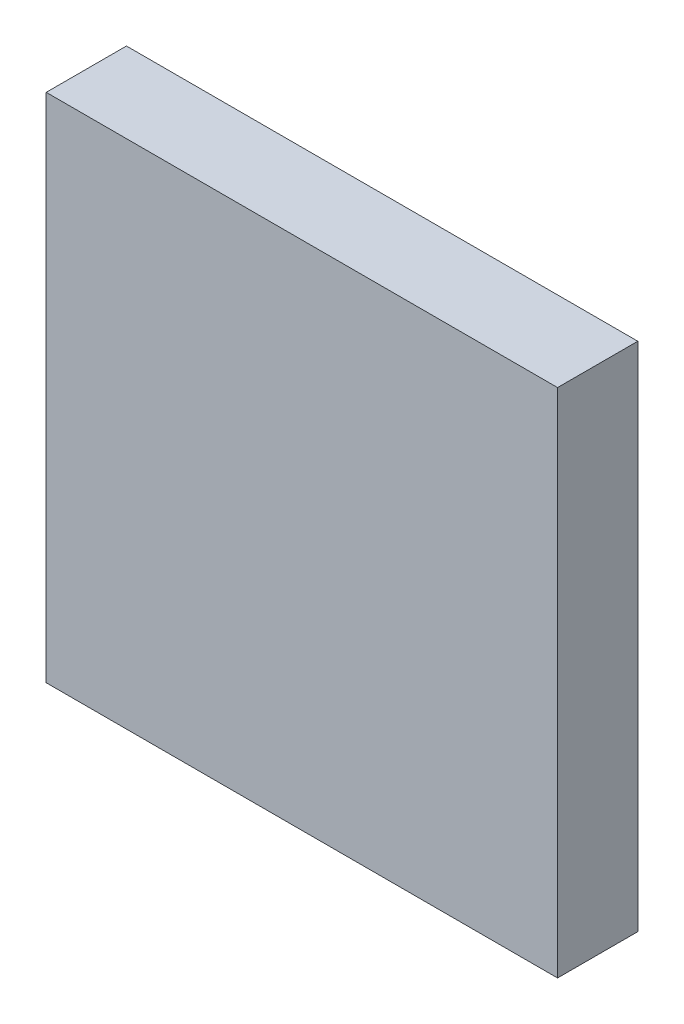
from build123d import *

# Parameters (mm, degrees)
SKETCH1_W           = 65
SKETCH1_H           = 65
BOSS_EXTRUDE1_DEPTH = 9
SKETCH2_W           = 65
SKETCH2_H           = 65
SKETCH2_W_2         = 60.2
SKETCH2_H_2         = 60.2
BOSS_EXTRUDE2_DEPTH = 1.2
SKETCH3_W           = 52.95
SKETCH3_H           = 52.95
CUT_EXTRUDE1_DEPTH  = 8
SKETCH4_W           = 2.557692308
SKETCH4_H           = 0.314102564
SKETCH4_W_2         = 0.314102564
SKETCH4_H_2         = 2.333333334
SKETCH4_H_3         = 2.333333333
CUT_EXTRUDE2_DEPTH  = 0.5


with BuildPart() as part:
    # Sketch1 → Boss-Extrude1 (new body)
    with BuildSketch(Plane.XY):
        with Locations((-5.537137766, -2.214696793)):
            Rectangle(SKETCH1_W, SKETCH1_H)
    extrude(amount=BOSS_EXTRUDE1_DEPTH)

    # Sketch2 → Boss-Extrude2 (add)
    with BuildSketch(Plane(origin=(0, 0, 0), x_dir=(-1, 0, 0), z_dir=(0, 0, -1))):
        with Locations((5.537137766, -2.214696793)):
            Rectangle(SKETCH2_W, SKETCH2_H)
        with Locations((5.537137766, -2.214696793)):
            Rectangle(SKETCH2_W_2, SKETCH2_H_2, mode=Mode.SUBTRACT)
    extrude(amount=BOSS_EXTRUDE2_DEPTH)

    # Sketch3 → Cut-Extrude1 (cut)
    with BuildSketch(Plane(origin=(0, 0, 0), x_dir=(-1, 0, 0), z_dir=(0, 0, -1))):
        with Locations((5.537137766, -2.214696793)):
            Rectangle(SKETCH3_W, SKETCH3_H)
    extrude(amount=-CUT_EXTRUDE1_DEPTH, mode=Mode.SUBTRACT)

    # Sketch4 → Cut-Extrude2 (cut)
    # profile 1 of 18: a face of its own
    with BuildSketch(Plane.ZY.offset(38.037137766)):
        with BuildLine():
            Line((3.58974359, 24.418743885), (0, 24.418743885))
            Line((0, 24.418743885), (0, 24.732846449))
            Line((0, 24.732846449), (0.442407853, 24.732846449))
            add(Edge.make_bspline(
                [(0.442407853, 24.732846449), (0.402357452, 24.768257833), (0.32419859, 24.837363595), (0.222394827, 24.952763581), (0.137553673, 25.074578698), (0.069666853, 25.203220871), (0.018284474, 25.338305204), (-0.017849104, 25.479446472), (-0.041371077, 25.626456568), (-0.04369442, 25.726712384), (-0.044871795, 25.777517923)],
                knots=[0, 0, 0, 0, 1.074295371, 2.096500925, 3.086030275, 4.053105238, 5.014108356, 5.985331429, 6.979048527, 8, 8, 8, 8], degree=3))
            add(Edge.make_bspline(
                [(-0.044871795, 25.777517923), (-0.043645626, 25.822686), (-0.041227567, 25.911759447), (-0.022462337, 26.042786759), (0.007657479, 26.168885525), (0.049598139, 26.290136111), (0.10494392, 26.405716945), (0.171919959, 26.516279293), (0.25089654, 26.622081189), (0.341535176, 26.721110502), (0.439877501, 26.812417983), (0.545073941, 26.892302806), (0.655679624, 26.960007795), (0.771663464, 27.01564917), (0.892940677, 27.058707384), (1.019428064, 27.088664249), (1.150915158, 27.107409258), (1.240455063, 27.109826092), (1.285857372, 27.111051577)],
                knots=[0, 0, 0, 0, 1.034036272, 2.039165313, 3.024406509, 3.999331371, 4.971254918, 5.953351348, 6.95522652, 7.989525907, 9.023492927, 10.024309745, 11.009187477, 11.988246066, 12.964946762, 13.950187958, 14.960617622, 16, 16, 16, 16], degree=3))
            add(Edge.make_bspline(
                [(1.285857372, 27.111051577), (1.330321265, 27.109798911), (1.418223983, 27.107322457), (1.547499942, 27.088864827), (1.672028314, 27.057850101), (1.791347799, 27.014241932), (1.905938937, 26.958570969), (2.014905164, 26.889701608), (2.119913357, 26.809845571), (2.21759609, 26.717562244), (2.307499363, 26.617644107), (2.386667873, 26.51125026), (2.453472192, 26.399707328), (2.507777609, 26.282791651), (2.550931998, 26.161331097), (2.581014763, 26.034402994), (2.598698613, 25.902584559), (2.601263226, 25.813095008), (2.602564103, 25.767702218)],
                knots=[0, 0, 0, 0, 1.02050356, 2.017480486, 2.990790918, 3.96161403, 4.928589988, 5.909588639, 6.91611943, 7.952353252, 8.989586576, 9.99823133, 10.991940466, 11.968822692, 12.952985106, 13.945868367, 14.958059758, 16, 16, 16, 16], degree=3))
            add(Edge.make_bspline(
                [(2.602564103, 25.767702218), (2.601004429, 25.715483081), (2.597942964, 25.612982719), (2.572093139, 25.462896042), (2.529212784, 25.320782238), (2.469910644, 25.186140284), (2.393386215, 25.059770513), (2.300152765, 24.941153953), (2.189114341, 24.831178187), (2.105480776, 24.766123426), (2.062700321, 24.732846449)],
                knots=[0, 0, 0, 0, 1.030970925, 2.023681352, 2.997808474, 3.956843046, 4.921958419, 5.908293655, 6.930045022, 8, 8, 8, 8], degree=3))
            Line((2.062700321, 24.732846449), (3.58974359, 24.732846449))
            Line((3.58974359, 24.732846449), (3.58974359, 24.418743885))
        make_face()
        with BuildLine():
            add(Edge.make_bspline(
                [(2.288461538, 25.763495487), (2.286827918, 25.809409853), (2.283603412, 25.900037507), (2.258429663, 26.03308111), (2.216546024, 26.160396026), (2.159260529, 26.281336451), (2.087245119, 26.394025615), (2.000074446, 26.494641812), (1.900520567, 26.584388808), (1.787746484, 26.658590078), (1.668225935, 26.72114913), (1.542337959, 26.764049108), (1.413575056, 26.792596145), (1.326206752, 26.795494279), (1.282351763, 26.796949013)],
                knots=[0, 0, 0, 0, 1.031093775, 2.03521511, 3.029845951, 4.035119871, 5.034286494, 6.024708811, 7.017619509, 8.03559408, 9.050082311, 10.039808432, 11.016071318, 12, 12, 12, 12], degree=3))
            add(Edge.make_bspline(
                [(1.282351763, 26.796949013), (1.238767492, 26.795066929), (1.151769786, 26.791310137), (1.022624311, 26.764801587), (0.897243126, 26.718871256), (0.776066955, 26.657740121), (0.66306139, 26.58187446), (0.561560746, 26.492872304), (0.474040482, 26.390973068), (0.400785993, 26.278039472), (0.341819613, 26.157604296), (0.300239861, 26.030892655), (0.273984486, 25.90013091), (0.270820672, 25.811060344), (0.269230769, 25.766299975)],
                knots=[0, 0, 0, 0, 0.979154363, 1.954470772, 2.947816011, 3.971783346, 4.997163654, 5.998045606, 6.995988793, 8.00538986, 9.015323546, 10.000094788, 10.994993517, 12, 12, 12, 12], degree=3))
            add(Edge.make_bspline(
                [(0.269230769, 25.766299975), (0.270865873, 25.720848072), (0.274109662, 25.630678657), (0.299704414, 25.497321916), (0.341067285, 25.367706983), (0.399172696, 25.24376192), (0.470855123, 25.128383469), (0.555144025, 25.024961361), (0.652350119, 24.936650559), (0.760039451, 24.862618306), (0.877544377, 24.804136537), (1.003184173, 24.762888588), (1.135971494, 24.737554641), (1.226849293, 24.734437546), (1.273237179, 24.732846449)],
                knots=[0, 0, 0, 0, 1.017484689, 2.018529338, 3.030031036, 4.058138743, 5.076350332, 6.065651025, 7.036469986, 8.00785331, 8.984076697, 9.96571663, 10.961615403, 12, 12, 12, 12], degree=3))
            add(Edge.make_bspline(
                [(1.273237179, 24.732846449), (1.308574996, 24.73380612), (1.378131003, 24.735695058), (1.480258715, 24.75012541), (1.577991728, 24.77308113), (1.671437013, 24.805424413), (1.760062376, 24.847926433), (1.844562515, 24.899133738), (1.924150324, 24.960096666), (1.998725013, 25.02895996), (2.066404356, 25.10518699), (2.126056362, 25.186244558), (2.176538373, 25.271928722), (2.216937187, 25.362179339), (2.249849087, 25.45630129), (2.271586828, 25.555196718), (2.286560777, 25.657868937), (2.28782128, 25.727915925), (2.288461538, 25.763495487)],
                knots=[0, 0, 0, 0, 1.050062701, 2.066855696, 3.059271411, 4.030305351, 4.999747758, 5.975466543, 6.961907836, 7.974539719, 8.98812422, 9.98710676, 10.961662635, 11.93785114, 12.922015094, 13.919620009, 14.94329489, 16, 16, 16, 16], degree=3))
        make_face(mode=Mode.SUBTRACT)
    # profile 2 of 18: a face of its own
    with BuildSketch(Plane.ZY.offset(38.037137766)):
        with BuildLine():
            add(Edge.make_bspline(
                [(3.634615385, 23.590017923), (3.63370731, 23.570529862), (3.631929126, 23.532368495), (3.616823357, 23.477129001), (3.590827583, 23.426880205), (3.557084436, 23.381645614), (3.515769317, 23.344148217), (3.46882621, 23.317260588), (3.41772133, 23.300095607), (3.382112539, 23.298010594), (3.363982372, 23.296949013)],
                knots=[0, 0, 0, 0, 1.054986045, 2.065865298, 3.074122704, 4.105114675, 5.109626121, 6.074217918, 7.019490725, 8, 8, 8, 8], degree=3))
            add(Edge.make_bspline(
                [(3.363982372, 23.296949013), (3.346322808, 23.298034343), (3.311411939, 23.300179911), (3.261193153, 23.317247899), (3.214903719, 23.344373638), (3.173669374, 23.381620656), (3.13994572, 23.426886797), (3.113944797, 23.477127258), (3.098840388, 23.532368953), (3.097062016, 23.570530017), (3.096153846, 23.590017923)],
                knots=[0, 0, 0, 0, 0.961106377, 1.899993565, 2.859409042, 3.870007927, 4.90724781, 5.921615355, 6.938620636, 8, 8, 8, 8], degree=3))
            add(Edge.make_bspline(
                [(3.096153846, 23.590017923), (3.097032849, 23.609282006), (3.098743713, 23.646777028), (3.114125508, 23.701000829), (3.139889179, 23.750441105), (3.174136064, 23.794935941), (3.214629537, 23.832921434), (3.261228119, 23.859947087), (3.311403037, 23.877060709), (3.346319817, 23.879200127), (3.363982372, 23.880282346)],
                knots=[0, 0, 0, 0, 1.055304112, 2.054011575, 3.063363921, 4.096942562, 5.122536081, 6.088009498, 7.032825006, 8, 8, 8, 8], degree=3))
            add(Edge.make_bspline(
                [(3.363982372, 23.880282346), (3.382115643, 23.879223991), (3.417730531, 23.877145316), (3.468790647, 23.859933804), (3.516045838, 23.833149636), (3.556618084, 23.794911397), (3.590884, 23.75044753), (3.616642695, 23.700999156), (3.63202579, 23.646777472), (3.633736474, 23.609282157), (3.634615385, 23.590017923)],
                knots=[0, 0, 0, 0, 0.986662878, 1.937868148, 2.908513651, 3.927890639, 4.955204348, 5.958438607, 6.951092507, 8, 8, 8, 8], degree=3))
        make_face()
    # profile 3 of 18: a face of its own
    with BuildSketch(Plane.ZY.offset(38.037137766)):
        with Locations((1.278846154, 23.58861568)):
            Rectangle(SKETCH4_W, SKETCH4_H)
    # profile 4 of 18: a face of its own
    with BuildSketch(Plane.ZY.offset(38.037137766)):
        with BuildLine():
            Line((2.238681891, 21.502077218), (2.019230769, 21.715218244))
            add(Edge.make_bspline(
                [(2.019230769, 21.715218244), (2.040548523, 21.73360573), (2.081646644, 21.769054639), (2.136522231, 21.825326376), (2.182990263, 21.881362136), (2.221225502, 21.936866372), (2.251316988, 21.991942663), (2.272570288, 22.047061255), (2.285913033, 22.102070895), (2.287622239, 22.138859883), (2.288461538, 22.156924975)],
                knots=[0, 0, 0, 0, 1.265880991, 2.440469525, 3.530740057, 4.536711111, 5.468008477, 6.34654737, 7.188078389, 8, 8, 8, 8], degree=3))
            add(Edge.make_bspline(
                [(2.288461538, 22.156924975), (2.287376181, 22.179058179), (2.285240351, 22.222613194), (2.264344046, 22.284934049), (2.231498561, 22.342383902), (2.185841467, 22.392539759), (2.132806978, 22.434797791), (2.074229729, 22.466827007), (2.01054531, 22.485582671), (1.966533213, 22.488020343), (1.944210737, 22.489256705)],
                knots=[0, 0, 0, 0, 1.000196853, 1.968245854, 2.94569445, 3.981000421, 5.021494845, 6.007172807, 6.989258906, 8, 8, 8, 8], degree=3))
            add(Edge.make_bspline(
                [(1.944210737, 22.489256705), (1.923998693, 22.488145893), (1.883631582, 22.4859274), (1.824083548, 22.468680721), (1.76602651, 22.441214648), (1.730463604, 22.415544454), (1.712139423, 22.402317603)],
                knots=[0, 0, 0, 0, 0.960159726, 1.917612774, 2.927026955, 4, 4, 4, 4], degree=3))
            add(Edge.make_bspline(
                [(1.712139423, 22.402317603), (1.702354839, 22.394354109), (1.681529584, 22.377404816), (1.652625731, 22.345596301), (1.62068348, 22.309573798), (1.588746643, 22.266253861), (1.555114918, 22.217502833), (1.521112785, 22.162263548), (1.48414836, 22.102289043), (1.460703924, 22.059351737), (1.448517628, 22.037033148)],
                knots=[0, 0, 0, 0, 0.66740084, 1.420478572, 2.27185888, 3.217733974, 4.268547843, 5.408967954, 6.65319498, 8, 8, 8, 8], degree=3))
            add(Edge.make_bspline(
                [(1.448517628, 22.037033148), (1.433272725, 22.00981957), (1.403824593, 21.9572519), (1.358114889, 21.882559133), (1.312683465, 21.814772092), (1.268016191, 21.753316425), (1.222863324, 21.699374616), (1.178955567, 21.651310063), (1.134966258, 21.610321619), (1.104233145, 21.587367692), (1.089543269, 21.576396128)],
                knots=[0, 0, 0, 0, 1.27191281, 2.456916733, 3.569705269, 4.599008579, 5.553216877, 6.436649441, 7.252746552, 8, 8, 8, 8], degree=3))
            add(Edge.make_bspline(
                [(1.089543269, 21.576396128), (1.059909466, 21.558094323), (1.00100518, 21.5217151), (0.903351967, 21.485002573), (0.800629714, 21.461537231), (0.729999555, 21.458664918), (0.694110577, 21.457205423)],
                knots=[0, 0, 0, 0, 0.995606783, 1.979007074, 2.973082153, 4, 4, 4, 4], degree=3))
            add(Edge.make_bspline(
                [(0.694110577, 21.457205423), (0.668840613, 21.457923306), (0.619043389, 21.459337972), (0.545720292, 21.469219735), (0.475542604, 21.486087601), (0.408099681, 21.509467354), (0.343522979, 21.539448322), (0.282298951, 21.577129536), (0.223907606, 21.620819131), (0.168677169, 21.67026099), (0.118568111, 21.725173868), (0.074973865, 21.784222006), (0.038155825, 21.84651615), (0.007930161, 21.912071495), (-0.016148907, 21.981027373), (-0.032808467, 22.0534408), (-0.042782037, 22.129068973), (-0.044166401, 22.180498861), (-0.044871795, 22.206704622)],
                knots=[0, 0, 0, 0, 1.032633728, 2.034917567, 3.017159222, 3.977707287, 4.947659047, 5.920662675, 6.910168127, 7.92466491, 8.94557085, 9.942744688, 10.919024275, 11.897637117, 12.88838639, 13.898512555, 14.929200919, 16, 16, 16, 16], degree=3))
            add(Edge.make_bspline(
                [(-0.044871795, 22.206704622), (-0.043879095, 22.242071797), (-0.041907487, 22.312314724), (-0.023401426, 22.416204443), (0.005393968, 22.517725202), (0.045109902, 22.616108742), (0.095260615, 22.709154856), (0.155323008, 22.794285781), (0.223313006, 22.871797243), (0.275425916, 22.915915517), (0.301482372, 22.937974654)],
                knots=[0, 0, 0, 0, 1.013940152, 2.01379169, 3.017749504, 4.037548394, 5.051665909, 6.043208538, 7.021604269, 8, 8, 8, 8], degree=3))
            Line((0.301482372, 22.937974654), (0.538461538, 22.729741481))
            add(Edge.make_bspline(
                [(0.538461538, 22.729741481), (0.517106774, 22.709969068), (0.475707334, 22.671637256), (0.420582993, 22.610336039), (0.374381722, 22.547956638), (0.335738307, 22.485121951), (0.305962904, 22.420901857), (0.28504431, 22.355656243), (0.271600118, 22.289517819), (0.270021836, 22.245095683), (0.269230769, 22.222830423)],
                knots=[0, 0, 0, 0, 1.179806542, 2.287233372, 3.337373186, 4.324005949, 5.273901747, 6.200048787, 7.097828587, 8, 8, 8, 8], degree=3))
            add(Edge.make_bspline(
                [(0.269230769, 22.222830423), (0.270601594, 22.192512497), (0.273279956, 22.133276356), (0.297597048, 22.048432597), (0.335727, 21.970093971), (0.389811698, 21.902070625), (0.452767271, 21.844168464), (0.52368139, 21.80224029), (0.600472847, 21.775964114), (0.653705149, 21.772878116), (0.680789263, 21.771307987)],
                knots=[0, 0, 0, 0, 1.072336372, 2.095165389, 3.102688358, 4.141489647, 5.156069229, 6.117746104, 7.042326257, 8, 8, 8, 8], degree=3))
            add(Edge.make_bspline(
                [(0.680789263, 21.771307987), (0.703098881, 21.772394282), (0.747146237, 21.774539024), (0.810896578, 21.791382296), (0.871365859, 21.817995149), (0.906755506, 21.844199797), (0.924779647, 21.857545968)],
                knots=[0, 0, 0, 0, 1.013901739, 2.00181326, 2.98231254, 4, 4, 4, 4], degree=3))
            add(Edge.make_bspline(
                [(0.924779647, 21.857545968), (0.93381501, 21.865568363), (0.953497292, 21.883044035), (0.98192237, 21.915099276), (1.01256047, 21.953481138), (1.044892059, 21.998621301), (1.078490664, 22.050610763), (1.113180016, 22.109660239), (1.150607742, 22.174960791), (1.175427397, 22.221131423), (1.188401442, 22.245266321)],
                knots=[0, 0, 0, 0, 0.615000592, 1.339693406, 2.178160186, 3.116406724, 4.166410947, 5.330106347, 6.604359322, 8, 8, 8, 8], degree=3))
            add(Edge.make_bspline(
                [(1.188401442, 22.245266321), (1.202940574, 22.271312961), (1.23113659, 22.321825708), (1.275052671, 22.393372999), (1.319719945, 22.457920353), (1.362632784, 22.517020928), (1.406053728, 22.569181934), (1.45003098, 22.614197882), (1.492790966, 22.653841098), (1.523088263, 22.675788509), (1.537560096, 22.68627193)],
                knots=[0, 0, 0, 0, 1.262093308, 2.447601706, 3.550203992, 4.582594899, 5.537233252, 6.418365656, 7.244515135, 8, 8, 8, 8], degree=3))
            add(Edge.make_bspline(
                [(1.537560096, 22.68627193), (1.566705711, 22.704402529), (1.625007126, 22.740670065), (1.722317603, 22.775885256), (1.824762661, 22.800091285), (1.895449515, 22.802253675), (1.931590545, 22.803359269)],
                knots=[0, 0, 0, 0, 0.985009483, 1.970363186, 2.962279964, 4, 4, 4, 4], degree=3))
            add(Edge.make_bspline(
                [(1.931590545, 22.803359269), (1.955215889, 22.802824997), (2.001454035, 22.801779349), (2.069393613, 22.793436387), (2.133939, 22.778240702), (2.196075886, 22.759200174), (2.2545413, 22.732664491), (2.310454167, 22.701148571), (2.362769164, 22.663116984), (2.411747706, 22.620368968), (2.456698919, 22.573897012), (2.49524325, 22.522999231), (2.528389265, 22.469497182), (2.556143863, 22.413079119), (2.577148114, 22.353261266), (2.591604713, 22.290446162), (2.601260131, 22.224765203), (2.602123186, 22.17986405), (2.602564103, 22.156924975)],
                knots=[0, 0, 0, 0, 1.087761869, 2.12890409, 3.144425528, 4.138218063, 5.116152125, 6.094559764, 7.089109474, 8.088306095, 9.085414286, 10.060442677, 11.0220762, 11.979848209, 12.949875201, 13.933947973, 14.944496518, 16, 16, 16, 16], degree=3))
            add(Edge.make_bspline(
                [(2.602564103, 22.156924975), (2.601462347, 22.129731577), (2.599238168, 22.074834661), (2.581492152, 21.99250085), (2.552592355, 21.91038159), (2.511740715, 21.828392716), (2.460358873, 21.746184919), (2.39711483, 21.664126686), (2.323793795, 21.580884824), (2.267686429, 21.52893337), (2.238681891, 21.502077218)],
                knots=[0, 0, 0, 0, 0.845753203, 1.707371858, 2.609134499, 3.549244224, 4.552329203, 5.621587647, 6.770486714, 8, 8, 8, 8], degree=3))
        make_face()
    # profile 5 of 18: a face of its own
    with BuildSketch(Plane.ZY.offset(38.037137766)):
        Polygon((3.58974359, 20.514897731), (3.58974359, 20.200795167), (2.557692308, 20.200795167), (2.557692308, 19.752077218), (2.243589744, 19.752077218), (2.243589744, 20.200795167), (0, 20.200795167), (0, 20.514897731), (2.243589744, 20.514897731), (2.243589744, 20.96361568), (2.557692308, 20.96361568), (2.557692308, 20.514897731), align=None)
    # profile 6 of 18: a face of its own
    with BuildSketch(Plane.ZY.offset(38.037137766)):
        with Locations((2.266025641, 18.091820808)):
            Rectangle(SKETCH4_W_2, SKETCH4_H_2)
    # profile 7 of 18: a face of its own
    with BuildSketch(Plane.ZY.offset(38.037137766)):
        with Locations((1.233974359, 18.091820808)):
            Rectangle(SKETCH4_W_2, SKETCH4_H_2)
    # profile 8 of 18: a face of its own
    with BuildSketch(Plane.ZY.offset(38.037137766)):
        with BuildLine():
            add(Edge.make_bspline(
                [(1.949819712, 14.774813596), (1.934863494, 14.74640725), (1.905602631, 14.690832088), (1.858639097, 14.611314572), (1.809579529, 14.538104124), (1.759963948, 14.470157399), (1.707831198, 14.408860281), (1.653776341, 14.353807164), (1.599247332, 14.303270891), (1.542110544, 14.259908338), (1.483544435, 14.221670547), (1.423045573, 14.188669159), (1.360804783, 14.160449106), (1.296127277, 14.138086925), (1.229967199, 14.119664927), (1.161469168, 14.106989377), (1.09108484, 14.100172445), (1.043516537, 14.098883633), (1.01943109, 14.098231064)],
                knots=[0, 0, 0, 0, 1.264385854, 2.473688339, 3.635349404, 4.734491366, 5.785876313, 6.801388178, 7.772322209, 8.711311751, 9.622826105, 10.524996139, 11.423212571, 12.31118177, 13.217849097, 14.126010572, 15.051135535, 16, 16, 16, 16], degree=3))
            add(Edge.make_bspline(
                [(1.01943109, 14.098231064), (0.985731043, 14.098995623), (0.919026006, 14.100508971), (0.820613537, 14.11390872), (0.724807576, 14.133465375), (0.632534359, 14.163919315), (0.542637586, 14.20029465), (0.456760952, 14.247089389), (0.372503128, 14.299603281), (0.320688994, 14.341868828), (0.294471154, 14.363255103)],
                knots=[0, 0, 0, 0, 1.02534174, 2.029536028, 3.018826961, 3.997522084, 4.983122576, 5.966563916, 6.971085759, 8, 8, 8, 8], degree=3))
            add(Edge.make_bspline(
                [(0.294471154, 14.363255103), (0.26387738, 14.391091577), (0.203067887, 14.446420543), (0.124117077, 14.54120347), (0.057767683, 14.645225354), (0.003695788, 14.758083687), (-0.038390071, 14.879476788), (-0.068632588, 15.009378793), (-0.085955018, 15.148042946), (-0.088459007, 15.243348417), (-0.08974359, 15.292241481)],
                knots=[0, 0, 0, 0, 0.954267603, 1.896743057, 2.838368354, 3.796610408, 4.779680527, 5.799409237, 6.871065594, 8, 8, 8, 8], degree=3))
            add(Edge.make_bspline(
                [(-0.08974359, 15.292241481), (-0.088588019, 15.339253787), (-0.086339396, 15.430734959), (-0.071187543, 15.563907741), (-0.044362975, 15.688196408), (-0.008407256, 15.804190209), (0.03954051, 15.910767628), (0.098310615, 16.008122058), (0.1665756, 16.097681813), (0.245980668, 16.176632106), (0.331040913, 16.246719544), (0.418791918, 16.308287853), (0.50924543, 16.359461867), (0.601051757, 16.402788979), (0.695497921, 16.435956997), (0.792097932, 16.458929209), (0.890683075, 16.473518522), (0.957214729, 16.475459657), (0.990685096, 16.476436192)],
                knots=[0, 0, 0, 0, 1.256882982, 2.445766618, 3.576898315, 4.651879663, 5.686612882, 6.692806257, 7.686348993, 8.689277895, 9.678883454, 10.630458183, 11.551151498, 12.454054546, 13.341321255, 14.221808008, 15.105437234, 16, 16, 16, 16], degree=3))
            add(Edge.make_bspline(
                [(0.990685096, 16.476436192), (1.015244307, 16.475858339), (1.063781975, 16.474716297), (1.135491035, 16.466811046), (1.205288166, 16.454104078), (1.273425224, 16.436839098), (1.339428159, 16.413468549), (1.403527597, 16.385149922), (1.466216033, 16.352449722), (1.526415781, 16.313254954), (1.586133098, 16.270103422), (1.642451146, 16.218915895), (1.698507293, 16.162775179), (1.751875993, 16.099389115), (1.805122356, 16.030697793), (1.854857868, 15.954619234), (1.904721532, 15.873290893), (1.934529056, 15.815484654), (1.949819712, 15.785831225)],
                knots=[0, 0, 0, 0, 0.941717298, 1.86116577, 2.762973304, 3.660719123, 4.553575492, 5.444450535, 6.34648071, 7.261375261, 8.197060099, 9.168336537, 10.175980388, 11.237504102, 12.343496232, 13.506792996, 14.721035322, 16, 16, 16, 16], degree=3))
            add(Edge.make_bspline(
                [(1.949819712, 15.785831225), (1.971951032, 15.826426804), (2.014803462, 15.905031208), (2.093596978, 16.009043695), (2.178623064, 16.098529534), (2.27269186, 16.170020768), (2.371660225, 16.226749649), (2.475211011, 16.266809626), (2.582104298, 16.292969286), (2.654997811, 16.295618512), (2.691606571, 16.296949013)],
                knots=[0, 0, 0, 0, 1.16709546, 2.25982348, 3.287408737, 4.277418348, 5.234967981, 6.16072867, 7.076276605, 8, 8, 8, 8], degree=3))
            add(Edge.make_bspline(
                [(2.691606571, 16.296949013), (2.728904089, 16.295313557), (2.803878607, 16.292026006), (2.915485339, 16.265443173), (3.025099461, 16.22212115), (3.132204844, 16.163207897), (3.233117751, 16.089790804), (3.323930684, 16.001727739), (3.402792466, 15.90052551), (3.469417484, 15.787980968), (3.52391263, 15.667102516), (3.56111313, 15.539344813), (3.585580587, 15.406990933), (3.588342965, 15.316891492), (3.58974359, 15.271207827)],
                knots=[0, 0, 0, 0, 0.888753872, 1.786550278, 2.720173491, 3.693036334, 4.694165094, 5.687489879, 6.699912706, 7.744713188, 8.800178723, 9.852977058, 10.911381959, 12, 12, 12, 12], degree=3))
            add(Edge.make_bspline(
                [(3.58974359, 15.271207827), (3.588303442, 15.226702407), (3.585463634, 15.13894279), (3.561546616, 15.009751545), (3.522044886, 14.88603779), (3.468258379, 14.768476597), (3.401184988, 14.659636643), (3.321527631, 14.562459412), (3.23103379, 14.477216862), (3.130394183, 14.406393173), (3.023291398, 14.349237835), (2.911902535, 14.308534502), (2.797720233, 14.282643864), (2.720486644, 14.279362354), (2.681790865, 14.277718244)],
                knots=[0, 0, 0, 0, 1.072712831, 2.115267497, 3.156282165, 4.197922255, 5.225560591, 6.230883479, 7.219814004, 8.214446311, 9.19021444, 10.138875805, 11.067534608, 12, 12, 12, 12], degree=3))
            add(Edge.make_bspline(
                [(2.681790865, 14.277718244), (2.643813976, 14.279152598), (2.569229525, 14.281969589), (2.460506217, 14.305672469), (2.358672191, 14.345574811), (2.262644704, 14.400110588), (2.173752347, 14.471078898), (2.092290668, 14.558358166), (2.01502137, 14.659239755), (1.972039418, 14.735427837), (1.949819712, 14.774813596)],
                knots=[0, 0, 0, 0, 0.975287281, 1.915408787, 2.843441052, 3.776938647, 4.743139116, 5.754296123, 6.83907365, 8, 8, 8, 8], degree=3))
        make_face()
        with BuildLine():
            add(Edge.make_bspline(
                [(3.230769231, 15.288735872), (3.23011779, 15.313286678), (3.228843288, 15.361318789), (3.222184651, 15.43174746), (3.209231434, 15.498719827), (3.191992722, 15.562935628), (3.168704734, 15.62351444), (3.141309725, 15.681278995), (3.108003659, 15.735246185), (3.070642462, 15.786067488), (3.029549555, 15.831818262), (2.986735837, 15.872422814), (2.941360445, 15.906150928), (2.894552085, 15.934792037), (2.844921509, 15.955573555), (2.793990332, 15.971137859), (2.741114948, 15.98165925), (2.704978438, 15.98244764), (2.686698718, 15.982846449)],
                knots=[0, 0, 0, 0, 1.203892937, 2.355340988, 3.463153438, 4.544400666, 5.610487187, 6.640501085, 7.674077295, 8.714426146, 9.728707835, 10.68524104, 11.601827946, 12.495867327, 13.368432065, 14.231010473, 15.105153427, 16, 16, 16, 16], degree=3))
            add(Edge.make_bspline(
                [(2.686698718, 15.982846449), (2.668426445, 15.982135344), (2.632317808, 15.9807301), (2.578781714, 15.970558893), (2.52685686, 15.953552548), (2.476058516, 15.930233193), (2.42651707, 15.900307167), (2.378042683, 15.863985907), (2.33191722, 15.819693445), (2.286832014, 15.7707812), (2.245294346, 15.717353228), (2.208190628, 15.661210148), (2.178611871, 15.601942225), (2.152677345, 15.541324396), (2.133223444, 15.478074735), (2.119208055, 15.412629355), (2.110538662, 15.345058165), (2.109499919, 15.299278361), (2.108974359, 15.27611568)],
                knots=[0, 0, 0, 0, 0.873213166, 1.72559466, 2.594724523, 3.479581045, 4.391597569, 5.35687048, 6.368548091, 7.443976143, 8.534559525, 9.600545123, 10.654815915, 11.696401765, 12.749428718, 13.812189468, 14.893058657, 16, 16, 16, 16], degree=3))
            add(Edge.make_bspline(
                [(2.108974359, 15.27611568), (2.109847226, 15.246365576), (2.111584339, 15.187159208), (2.127735513, 15.099879877), (2.153141431, 15.015017232), (2.187901397, 14.933478328), (2.231529257, 14.857373743), (2.283762275, 14.789533674), (2.343394372, 14.730536781), (2.409497208, 14.680996171), (2.479848796, 14.642586325), (2.550449089, 14.612684517), (2.62205132, 14.595223302), (2.670018284, 14.592945735), (2.693709936, 14.591820808)],
                knots=[0, 0, 0, 0, 1.076279235, 2.141928126, 3.20205304, 4.278698113, 5.344010996, 6.36967002, 7.368914609, 8.37248503, 9.349703398, 10.264243087, 11.142681841, 12, 12, 12, 12], degree=3))
            add(Edge.make_bspline(
                [(2.693709936, 14.591820808), (2.710338774, 14.59235133), (2.743344633, 14.593404341), (2.792071206, 14.60212462), (2.839745963, 14.61642299), (2.88638046, 14.63614497), (2.932630465, 14.660576997), (2.976543463, 14.69213868), (3.020563317, 14.727966518), (3.062739211, 14.76958665), (3.102452947, 14.816506482), (3.136616972, 14.869466748), (3.166287876, 14.9271203), (3.190128855, 14.989937495), (3.208084837, 15.057673218), (3.221517253, 15.130068746), (3.229091489, 15.207712435), (3.230197854, 15.261142294), (3.230769231, 15.288735872)],
                knots=[0, 0, 0, 0, 0.814272661, 1.61621452, 2.416847352, 3.248328223, 4.093649164, 4.973549185, 5.892801723, 6.872536627, 7.872406081, 8.898230315, 9.953166191, 11.044090313, 12.18293744, 13.382234284, 14.648068262, 16, 16, 16, 16], degree=3))
        make_face(mode=Mode.SUBTRACT)
        with BuildLine():
            add(Edge.make_bspline(
                [(1.75, 15.26840334), (1.749446567, 15.299529237), (1.748360867, 15.360590652), (1.736268416, 15.450046003), (1.719449764, 15.535904908), (1.693880056, 15.617844075), (1.660907042, 15.69576305), (1.620565407, 15.769837356), (1.573591505, 15.84017181), (1.519728697, 15.905613977), (1.46139391, 15.96523861), (1.400427735, 16.018468435), (1.336392276, 16.062776278), (1.269858747, 16.098981553), (1.200910037, 16.12702728), (1.12955999, 16.147735933), (1.055595347, 16.159757002), (1.005450812, 16.161469964), (0.980168269, 16.162333628)],
                knots=[0, 0, 0, 0, 1.140506561, 2.237395584, 3.304560074, 4.345354409, 5.3782877, 6.402081073, 7.433555996, 8.474808822, 9.504965884, 10.489266388, 11.437701257, 12.354123303, 13.261162422, 14.161620169, 15.073101032, 16, 16, 16, 16], degree=3))
            add(Edge.make_bspline(
                [(0.980168269, 16.162333628), (0.948735351, 16.160974131), (0.886373177, 16.158276919), (0.794239963, 16.136764462), (0.704794376, 16.102507224), (0.61961023, 16.053548487), (0.539748681, 15.994193477), (0.469336771, 15.921683582), (0.408123535, 15.838853105), (0.357931866, 15.744875792), (0.317670369, 15.642362512), (0.290275629, 15.531047579), (0.272003393, 15.412502566), (0.270169542, 15.330641581), (0.269230769, 15.288735872)],
                knots=[0, 0, 0, 0, 0.898956152, 1.783507998, 2.694187257, 3.631865312, 4.587204618, 5.533364321, 6.51415483, 7.525942309, 8.574485006, 9.65837228, 10.801290154, 12, 12, 12, 12], degree=3))
            add(Edge.make_bspline(
                [(0.269230769, 15.288735872), (0.269858865, 15.255985222), (0.271082598, 15.192176453), (0.281906756, 15.099094411), (0.299021259, 15.011235951), (0.324151723, 14.928644183), (0.35425954, 14.850329357), (0.393634191, 14.778042738), (0.438163667, 14.70985896), (0.491016297, 14.648978787), (0.547539231, 14.593612876), (0.607068124, 14.545119445), (0.668996719, 14.504078406), (0.733291339, 14.470995554), (0.799715049, 14.444724567), (0.868540689, 14.425786187), (0.940038556, 14.414113927), (0.988537267, 14.412932491), (1.013120994, 14.412333628)],
                knots=[0, 0, 0, 0, 1.22469164, 2.386092043, 3.500511288, 4.568136916, 5.611981868, 6.63276519, 7.641422348, 8.65223666, 9.641383647, 10.598487484, 11.519869765, 12.415254456, 13.298392158, 14.187051141, 15.081026348, 16, 16, 16, 16], degree=3))
            add(Edge.make_bspline(
                [(1.013120994, 14.412333628), (1.037001011, 14.413233541), (1.084088235, 14.415008011), (1.153815934, 14.426430795), (1.221454814, 14.446043837), (1.286713815, 14.47462879), (1.350298253, 14.509784538), (1.411738337, 14.552907754), (1.470546823, 14.604503608), (1.526785046, 14.662944286), (1.578804878, 14.726595516), (1.62481824, 14.794264694), (1.66357064, 14.865418619), (1.695087059, 14.939909974), (1.719874549, 15.017572491), (1.737190539, 15.09834928), (1.748090143, 15.182334852), (1.749356189, 15.239389723), (1.75, 15.26840334)],
                knots=[0, 0, 0, 0, 0.917481483, 1.809113215, 2.707052678, 3.61610275, 4.54058801, 5.494688304, 6.493986409, 7.541809048, 8.607637092, 9.648666143, 10.681335566, 11.715370464, 12.751897579, 13.808646822, 14.885650252, 16, 16, 16, 16], degree=3))
        make_face(mode=Mode.SUBTRACT)
    # profile 9 of 18: a face of its own
    with BuildSketch(Plane.ZY.offset(38.037137766)):
        Polygon((0.628205128, 13.25267818), (0.47255609, 12.931564398), (-0.448717949, 13.413936192), (-0.346354167, 13.649513116), align=None)
    # profile 10 of 18: a face of its own
    with BuildSketch(Plane.ZY.offset(38.037137766)):
        Polygon((3.58974359, 11.899513116), (3.58974359, 11.585410551), (2.557692308, 11.585410551), (2.557692308, 11.136692603), (2.243589744, 11.136692603), (2.243589744, 11.585410551), (0, 11.585410551), (0, 11.899513116), (2.243589744, 11.899513116), (2.243589744, 12.348231064), (2.557692308, 12.348231064), (2.557692308, 11.899513116), align=None)
    # profile 11 of 18: a face of its own
    with BuildSketch(Plane.ZY.offset(38.037137766)):
        with BuildLine():
            Line((3.58974359, 10.553359269), (3.58974359, 10.239256705))
            Line((3.58974359, 10.239256705), (2.074619391, 10.239256705))
            add(Edge.make_bspline(
                [(2.074619391, 10.239256705), (2.116709489, 10.205488797), (2.198531029, 10.139845275), (2.306365252, 10.030057019), (2.39842264, 9.915947689), (2.472610812, 9.795597695), (2.530726281, 9.670678831), (2.572525737, 9.540540627), (2.597662169, 9.404956687), (2.600918576, 9.312712467), (2.602564103, 9.266099654)],
                knots=[0, 0, 0, 0, 1.125719942, 2.188356526, 3.205611246, 4.180516366, 5.132291467, 6.075069812, 7.02729502, 8, 8, 8, 8], degree=3))
            add(Edge.make_bspline(
                [(2.602564103, 9.266099654), (2.600816077, 9.218770541), (2.597394769, 9.12613605), (2.570417974, 8.991236548), (2.524054695, 8.865148479), (2.461248688, 8.748072841), (2.382603128, 8.643108571), (2.29130959, 8.550970273), (2.186318658, 8.475075922), (2.089025747, 8.423514116), (2.002492275, 8.389935333), (1.928254522, 8.368684769), (1.845532988, 8.350665185), (1.754368139, 8.334965568), (1.654323003, 8.32450195), (1.545848738, 8.316097343), (1.428951623, 8.310120885), (1.348031373, 8.309889281), (1.306189904, 8.309769526)],
                knots=[0, 0, 0, 0, 1.23557613, 2.418320525, 3.575024647, 4.733016537, 5.875704003, 6.989294038, 8.107658508, 9.246262776, 9.854990416, 10.529125826, 11.260725398, 12.065539328, 12.943870397, 13.886749146, 14.907300446, 16, 16, 16, 16], degree=3))
            Line((1.306189904, 8.309769526), (0, 8.309769526))
            Line((0, 8.309769526), (0, 8.62387209))
            Line((0, 8.62387209), (1.203125, 8.62387209))
            add(Edge.make_bspline(
                [(1.203125, 8.62387209), (1.23794767, 8.624062393), (1.30455751, 8.624426411), (1.399923618, 8.625629755), (1.486419753, 8.628315971), (1.563768705, 8.632656796), (1.632078308, 8.637222104), (1.691249362, 8.643505421), (1.741363138, 8.650815655), (1.771527766, 8.657384436), (1.78505609, 8.660330423)],
                knots=[0, 0, 0, 0, 1.430932559, 2.737130458, 3.918967929, 4.986496826, 5.920444988, 6.731744033, 7.431208747, 8, 8, 8, 8], degree=3))
            add(Edge.make_bspline(
                [(1.78505609, 8.660330423), (1.82475051, 8.671754613), (1.901062802, 8.693717551), (2.00472313, 8.744766265), (2.093115107, 8.808522713), (2.165003309, 8.886379217), (2.22162991, 8.977088824), (2.260238761, 9.081107793), (2.284852114, 9.197179612), (2.287222555, 9.278817652), (2.288461538, 9.321488276)],
                knots=[0, 0, 0, 0, 1.090097712, 2.095706502, 3.037208793, 3.95517211, 4.879102211, 5.845071496, 6.873660557, 8, 8, 8, 8], degree=3))
            add(Edge.make_bspline(
                [(2.288461538, 9.321488276), (2.287985712, 9.346756049), (2.287044064, 9.396760319), (2.277590166, 9.470908985), (2.262141447, 9.542838049), (2.241236908, 9.613240226), (2.212791372, 9.680623424), (2.179861183, 9.746951749), (2.139552928, 9.810345958), (2.09432716, 9.871931775), (2.0442574, 9.929249308), (1.991410445, 9.982576424), (1.935135481, 10.030114764), (1.876335365, 10.073183355), (1.814203572, 10.110361641), (1.749339253, 10.142814723), (1.681657108, 10.170350419), (1.634682046, 10.184033111), (1.611177885, 10.190879301)],
                knots=[0, 0, 0, 0, 1.024319606, 2.027102035, 3.025350316, 4.005802111, 5.00026367, 5.987881639, 7.005602596, 8.042517216, 9.083927026, 10.089214625, 11.084353441, 12.06828073, 13.041928858, 14.016821737, 15.00770877, 16, 16, 16, 16], degree=3))
            add(Edge.make_bspline(
                [(1.611177885, 10.190879301), (1.594156934, 10.194818729), (1.557066187, 10.203403225), (1.495891863, 10.212718059), (1.424805491, 10.221055855), (1.34391489, 10.228104405), (1.252923648, 10.232427492), (1.152452689, 10.237085732), (1.041872668, 10.238819746), (0.964977161, 10.239106699), (0.924779647, 10.239256705)],
                knots=[0, 0, 0, 0, 0.607992626, 1.324890765, 2.152360218, 3.099583803, 4.150613268, 5.323148443, 6.60066238, 8, 8, 8, 8], degree=3))
            Line((0.924779647, 10.239256705), (0, 10.239256705))
            Line((0, 10.239256705), (0, 10.553359269))
            Line((0, 10.553359269), (3.58974359, 10.553359269))
        make_face()
    # profile 12 of 18: a face of its own
    with BuildSketch(Plane.ZY.offset(38.037137766)):
        with BuildLine():
            add(Edge.make_bspline(
                [(3.634615385, 7.481043564), (3.63370731, 7.461555503), (3.631929126, 7.423394136), (3.616823357, 7.368154642), (3.590827583, 7.317905846), (3.557084436, 7.272671255), (3.515769317, 7.235173858), (3.46882621, 7.208286229), (3.41772133, 7.191121248), (3.382112539, 7.189036235), (3.363982372, 7.187974654)],
                knots=[0, 0, 0, 0, 1.054986045, 2.065865298, 3.074122704, 4.105114675, 5.109626121, 6.074217918, 7.019490725, 8, 8, 8, 8], degree=3))
            add(Edge.make_bspline(
                [(3.363982372, 7.187974654), (3.346322808, 7.189059984), (3.311411939, 7.191205552), (3.261193153, 7.20827354), (3.214903719, 7.235399279), (3.173669374, 7.272646297), (3.13994572, 7.317912438), (3.113944797, 7.368152899), (3.098840388, 7.423394594), (3.097062016, 7.461555658), (3.096153846, 7.481043564)],
                knots=[0, 0, 0, 0, 0.961106377, 1.899993565, 2.859409042, 3.870007927, 4.90724781, 5.921615355, 6.938620636, 8, 8, 8, 8], degree=3))
            add(Edge.make_bspline(
                [(3.096153846, 7.481043564), (3.097032849, 7.500307648), (3.098743713, 7.537802669), (3.114125508, 7.59202647), (3.139889179, 7.641466746), (3.174136064, 7.685961582), (3.214629537, 7.723947075), (3.261228119, 7.750972728), (3.311403037, 7.76808635), (3.346319817, 7.770225768), (3.363982372, 7.771307987)],
                knots=[0, 0, 0, 0, 1.055304112, 2.054011575, 3.063363921, 4.096942562, 5.122536081, 6.088009498, 7.032825006, 8, 8, 8, 8], degree=3))
            add(Edge.make_bspline(
                [(3.363982372, 7.771307987), (3.382115643, 7.770249632), (3.417730531, 7.768170957), (3.468790647, 7.750959445), (3.516045838, 7.724175277), (3.556618084, 7.685937038), (3.590884, 7.641473171), (3.616642695, 7.592024797), (3.63202579, 7.537803113), (3.633736474, 7.500307798), (3.634615385, 7.481043564)],
                knots=[0, 0, 0, 0, 0.986662878, 1.937868148, 2.908513651, 3.927890639, 4.955204348, 5.958438607, 6.951092507, 8, 8, 8, 8], degree=3))
        make_face()
    # profile 13 of 18: a face of its own
    with BuildSketch(Plane.ZY.offset(38.037137766)):
        with Locations((1.278846154, 7.479641321)):
            Rectangle(SKETCH4_W, SKETCH4_H)
    # profile 14 of 18: a face of its own
    with BuildSketch(Plane.ZY.offset(38.037137766)):
        with BuildLine():
            Line((2.003104968, 4.091820808), (1.83974359, 4.354741481))
            add(Edge.make_bspline(
                [(1.83974359, 4.354741481), (1.875575019, 4.383569737), (1.946103104, 4.440313266), (2.037069702, 4.538875473), (2.115517794, 4.643966373), (2.178593404, 4.757567445), (2.228385102, 4.878683364), (2.262989677, 5.00756365), (2.284740583, 5.144168537), (2.287200898, 5.237836618), (2.288461538, 5.285831225)],
                knots=[0, 0, 0, 0, 1.026629843, 2.020746545, 2.988156479, 3.951609825, 4.916760838, 5.907688704, 6.927920211, 8, 8, 8, 8], degree=3))
            add(Edge.make_bspline(
                [(2.288461538, 5.285831225), (2.287404632, 5.324190136), (2.285323084, 5.39973697), (2.272313503, 5.510643769), (2.248668193, 5.616283785), (2.217529159, 5.717332931), (2.175735107, 5.813022384), (2.125181733, 5.903620222), (2.065653632, 5.989429473), (1.997579651, 6.069086978), (1.922809808, 6.141682803), (1.843849662, 6.205887746), (1.760146373, 6.259475313), (1.673288589, 6.304144831), (1.581782059, 6.337753362), (1.486738455, 6.362468249), (1.387532367, 6.377532969), (1.320030561, 6.379358275), (1.285857372, 6.380282346)],
                knots=[0, 0, 0, 0, 1.11253269, 2.191102883, 3.232049486, 4.248096668, 5.252846381, 6.25411548, 7.252444123, 8.276484619, 9.287796331, 10.271127345, 11.222403915, 12.165070373, 13.097940083, 14.043161362, 15.009338842, 16, 16, 16, 16], degree=3))
            add(Edge.make_bspline(
                [(1.285857372, 6.380282346), (1.241086201, 6.378507113), (1.152147111, 6.374980567), (1.020898021, 6.347219618), (0.893761319, 6.302069035), (0.772436265, 6.239060636), (0.659946172, 6.160669228), (0.558232883, 6.069196295), (0.471531271, 5.962612463), (0.398968727, 5.844046054), (0.340401174, 5.7156379), (0.299073636, 5.578405916), (0.273989064, 5.433518743), (0.270837582, 5.334310249), (0.269230769, 5.283727859)],
                knots=[0, 0, 0, 0, 0.966447457, 1.919872872, 2.884287729, 3.873230387, 4.863319139, 5.838939256, 6.818209587, 7.819967013, 8.834377336, 9.85802846, 10.90789553, 12, 12, 12, 12], degree=3))
            add(Edge.make_bspline(
                [(0.269230769, 5.283727859), (0.270530266, 5.237372675), (0.273084123, 5.146272436), (0.294613087, 5.013105151), (0.32985672, 4.88632524), (0.37900437, 4.76593721), (0.442531886, 4.652161044), (0.520891057, 4.545731869), (0.611827657, 4.444531931), (0.682145629, 4.385034954), (0.717948718, 4.354741481)],
                knots=[0, 0, 0, 0, 1.039848629, 2.043578496, 3.018386758, 3.987534228, 4.954977003, 5.934852016, 6.948509513, 8, 8, 8, 8], degree=3))
            Line((0.717948718, 4.354741481), (0.545472756, 4.091820808))
            add(Edge.make_bspline(
                [(0.545472756, 4.091820808), (0.522582216, 4.107408643), (0.476877113, 4.138532577), (0.412430209, 4.190558213), (0.352119037, 4.246685543), (0.295961602, 4.306650785), (0.242972846, 4.369692917), (0.194654445, 4.437452904), (0.149783722, 4.508777196), (0.109120817, 4.583993028), (0.072649661, 4.662359641), (0.041087304, 4.743879427), (0.014401405, 4.828184135), (-0.007191812, 4.915084325), (-0.024274611, 5.004717131), (-0.035636087, 5.097014296), (-0.044109256, 5.191958549), (-0.044615411, 5.256130608), (-0.044871795, 5.288635712)],
                knots=[0, 0, 0, 0, 0.954067324, 1.904967979, 2.850944488, 3.791040077, 4.734579251, 5.686741025, 6.656553487, 7.63677735, 8.631289747, 9.633371755, 10.647134148, 11.676547777, 12.717490898, 13.789379914, 14.88025357, 16, 16, 16, 16], degree=3))
            add(Edge.make_bspline(
                [(-0.044871795, 5.288635712), (-0.043980515, 5.338246595), (-0.0422336, 5.435484287), (-0.023025126, 5.577806797), (0.005932495, 5.713820454), (0.047496211, 5.84347885), (0.101001052, 5.966801946), (0.166357724, 6.083675578), (0.244110425, 6.193709663), (0.332869742, 6.295827774), (0.429123096, 6.389582236), (0.532927558, 6.470204906), (0.64082011, 6.539759758), (0.754057284, 6.597120644), (0.873067504, 6.640451621), (0.996919148, 6.671290164), (1.12560932, 6.690924095), (1.213336996, 6.693220631), (1.2578125, 6.69438491)],
                knots=[0, 0, 0, 0, 1.112900083, 2.181292239, 3.217426397, 4.231060065, 5.231907716, 6.230057215, 7.231385915, 8.250448267, 9.26326716, 10.242335464, 11.195469137, 12.140906363, 13.085222324, 14.031808558, 15.002181388, 16, 16, 16, 16], degree=3))
            add(Edge.make_bspline(
                [(1.2578125, 6.69438491), (1.287986107, 6.693917064), (1.348006391, 6.692986441), (1.437210332, 6.68331627), (1.524834339, 6.668832608), (1.610752657, 6.648270557), (1.695225183, 6.622468541), (1.777800789, 6.590040362), (1.858959941, 6.552090178), (1.937703339, 6.507937925), (2.013554146, 6.459235092), (2.086080502, 6.406311567), (2.153424895, 6.348257359), (2.217272774, 6.286300622), (2.27571789, 6.219502702), (2.33128528, 6.149108021), (2.38109605, 6.073379448), (2.427609275, 5.994247029), (2.468951856, 5.911608527), (2.504589631, 5.82604557), (2.535040988, 5.738051543), (2.559150238, 5.647491669), (2.579367572, 5.554965423), (2.592085442, 5.459744105), (2.601071709, 5.362191877), (2.602062502, 5.296135855), (2.602564103, 5.262694205)],
                knots=[0, 0, 0, 0, 0.991083503, 1.971428668, 2.944771278, 3.907728914, 4.872032831, 5.84458753, 6.820199395, 7.813689706, 8.808455339, 9.780676499, 10.761021664, 11.727616056, 12.70141294, 13.675300653, 14.672050164, 15.67696011, 16.690052069, 17.705469636, 18.720567748, 19.746988726, 20.783187267, 21.830086354, 22.901455311, 24, 24, 24, 24], degree=3))
            add(Edge.make_bspline(
                [(2.602564103, 5.262694205), (2.601642457, 5.22081398), (2.599803771, 5.137262865), (2.58432148, 5.013323907), (2.56099875, 4.891202138), (2.526375122, 4.773079438), (2.484767812, 4.660444891), (2.43714288, 4.555215335), (2.38318024, 4.459040706), (2.323192746, 4.37102756), (2.255871557, 4.29082647), (2.180053861, 4.21757781), (2.096198315, 4.149744568), (2.034392181, 4.111288075), (2.003104968, 4.091820808)],
                knots=[0, 0, 0, 0, 1.095247575, 2.185020588, 3.262981163, 4.344680461, 5.40090428, 6.402280576, 7.363136638, 8.282296962, 9.184898179, 10.097200524, 11.036773704, 12, 12, 12, 12], degree=3))
        make_face()
    # profile 15 of 18: a face of its own
    with BuildSketch(Plane.ZY.offset(38.037137766)):
        Polygon((3.58974359, 3.46361568), (3.58974359, 3.149513116), (1.514423077, 3.149513116), (2.557692308, 1.985650936), (2.557692308, 1.5341285), (1.346153846, 2.884489077), (0, 1.399513116), (0, 1.85033443), (1.178585737, 3.149513116), (0, 3.149513116), (0, 3.46361568), align=None)
    # profile 16 of 18: a face of its own
    with BuildSketch(Plane.ZY.offset(38.037137766)):
        with Locations((2.266025641, -0.036384321)):
            Rectangle(SKETCH4_W_2, SKETCH4_H_3)
    # profile 17 of 18: a face of its own
    with BuildSketch(Plane.ZY.offset(38.037137766)):
        with Locations((1.233974359, -0.036384321)):
            Rectangle(SKETCH4_W_2, SKETCH4_H_3)
    # profile 18 of 18: a face of its own
    with BuildSketch(Plane.ZY.offset(38.037137766)):
        Polygon((3.5, -2.39565916), (3.5, -3.042794577), (0, -3.042794577), (0, -2.728692013), (3.141025641, -2.728692013), (3.141025641, -2.190230474), align=None)
    extrude(amount=-CUT_EXTRUDE2_DEPTH, mode=Mode.SUBTRACT)


solid = part.part
